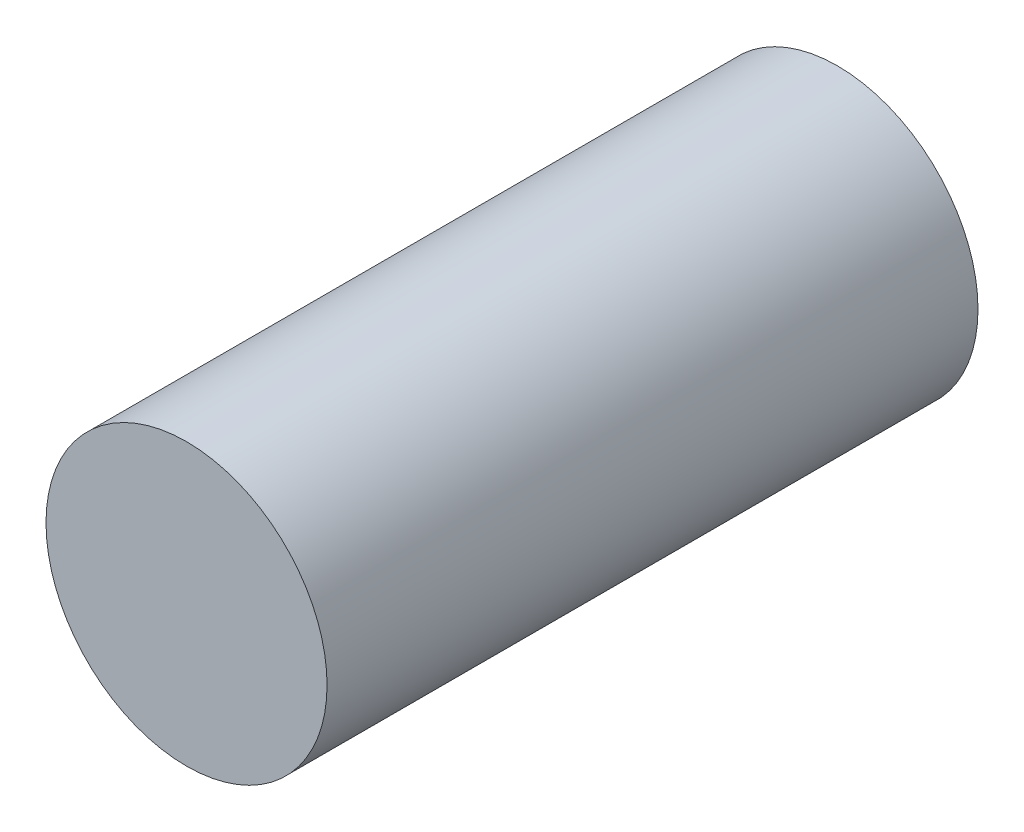
from build123d import *

# Parameters (mm, degrees)
ESQUISSE1_R        = 2.5
BOSS_EXTRU_1_DEPTH = 11.58


with BuildPart() as part:
    # Esquisse1 → Boss.-Extru.1 (new body)
    with BuildSketch(Plane.XY):
        Circle(ESQUISSE1_R)
    extrude(amount=BOSS_EXTRU_1_DEPTH)


solid = part.part
